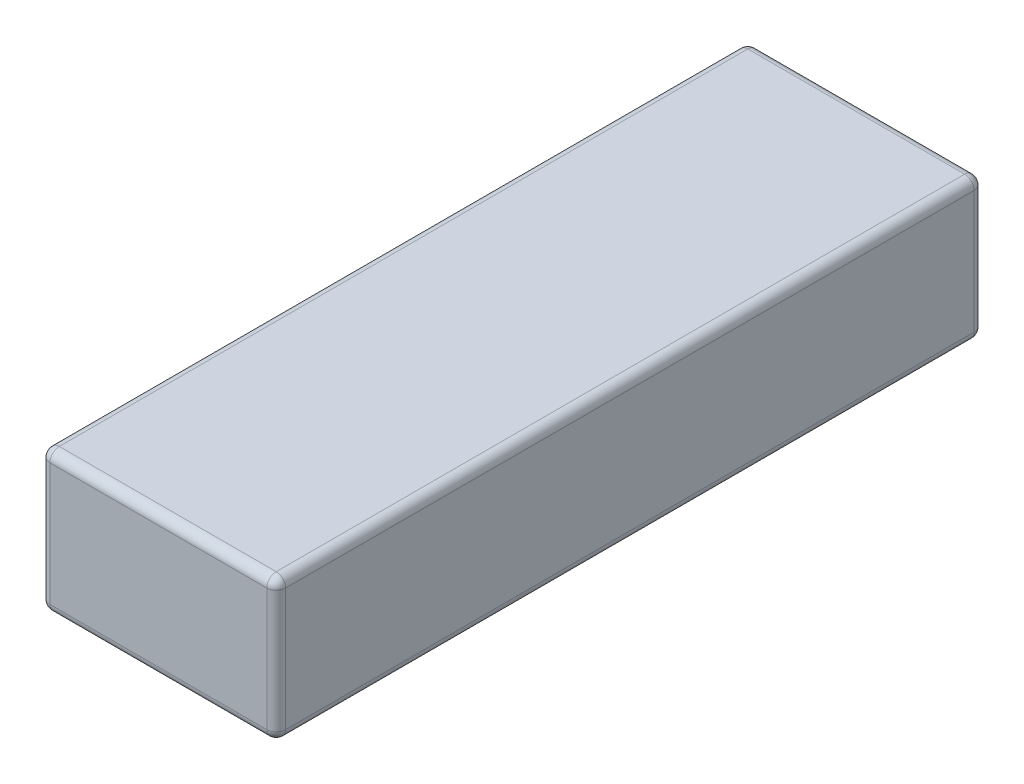
from build123d import *

# Parameters (mm, degrees)
SKETCH2_W           = 50
SKETCH2_H           = 150
BOSS_EXTRUDE1_DEPTH = 30
FILLET1_R           = 2
SKETCH3_R           = 13
CUT_EXTRUDE1_DEPTH  = 0.3


with BuildPart() as part:
    # Sketch2 → Boss-Extrude1 (new body)
    with BuildSketch(Plane(origin=(0, 0, 0), x_dir=(1, 0, 0), z_dir=(0, 1, 0))):
        Rectangle(SKETCH2_W, SKETCH2_H)
    extrude(amount=BOSS_EXTRUDE1_DEPTH)

    # Fillet1
    fillet1_edges = [part.edges().sort_by_distance(p)[0] for p in [
        (-25, 30, 0),
        (0, 30, 75),
        (25, 30, 0),
        (0, 0, 75),
        (-25, 0, 0),
        (0, 0, -75),
        (25, 0, 0),
        (25, 15, 75),
        (-25, 15, 75),
        (-25, 15, -75),
        (25, 15, -75),
        (0, 30, -75),
    ]]
    fillet(fillet1_edges, radius=FILLET1_R)

    # Sketch3 → Cut-Extrude1 (cut)
    with BuildSketch(Plane(origin=(0, 0, -75), x_dir=(-1, 0, 0), z_dir=(0, 0, -1))):
        with Locations((0, 15)):
            Circle(SKETCH3_R)
    extrude(amount=-CUT_EXTRUDE1_DEPTH, mode=Mode.SUBTRACT)


solid = part.part
